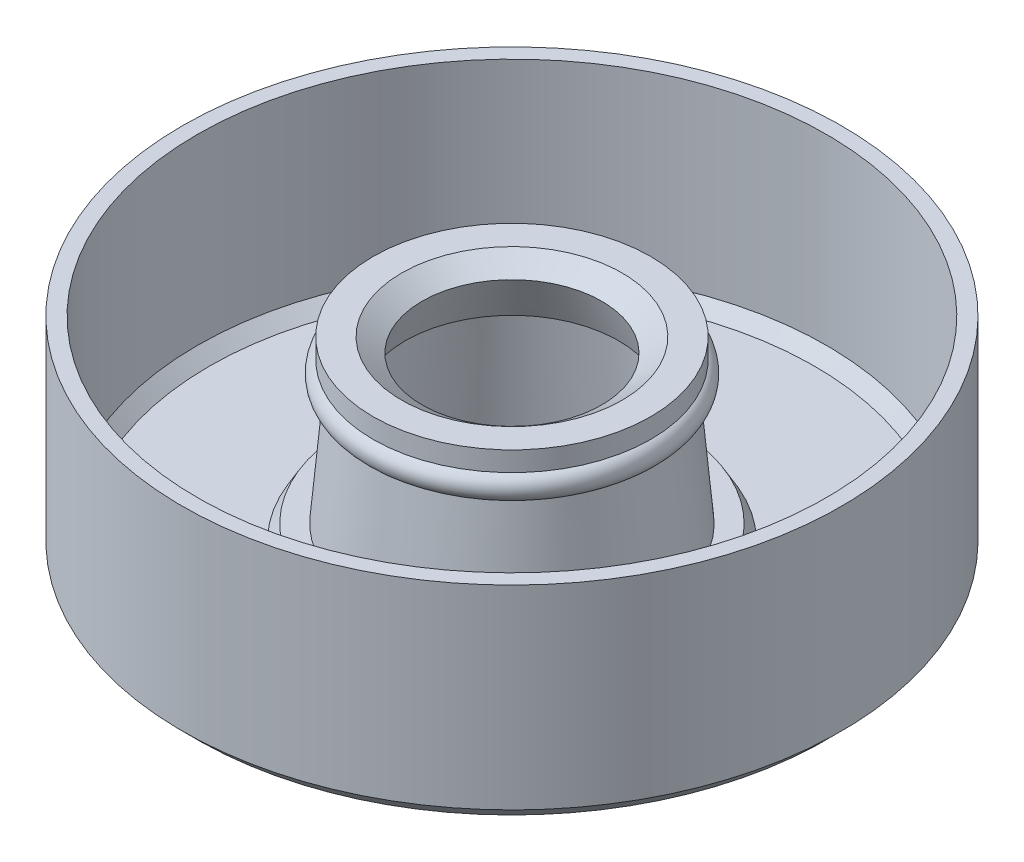
from build123d import *


with BuildPart() as part:
    # 草图1 → 旋转1 (revolve)
    with BuildSketch(Plane.XY):
        with BuildLine():
            Line((-10.5, 0), (-5.769439135, 0))
            ThreePointArc((-5.769439135, 0), (-5.259121106, 0.133562425), (-4.879665027, 0.5))
            Line((-4.879665027, 0.5), (-4.315491633, 0))
            Line((-4.315491633, 0), (-3.565536978, 0.06561253))
            Line((-3.565536978, 0.06561253), (-4.315491633, 0.5))
            Line((-4.315491633, 0.5), (-3.965536978, 4.5))
            Line((-3.965536978, 4.5), (-3.565536978, 4.5))
            Line((-3.565536978, 4.5), (-3, 5.928571429))
            Line((-3, 5.928571429), (-3.680070479, 6.404761905))
            Line((-3.680070479, 6.404761905), (-4.632451432, 6.404761905))
            Line((-4.632451432, 6.404761905), (-4.632451432, 5.747213595))
            ThreePointArc((-4.632451432, 5.747213595), (-4.867701612, 5.244464966), (-4.432451432, 4.9))
            Line((-4.432451432, 4.9), (-4.77365722, 1))
            Line((-4.77365722, 1), (-5.480764001, 1))
            Line((-5.480764001, 1), (-5.769439135, 0.5))
            Line((-5.769439135, 0.5), (-10.1, 0.5))
            Line((-10.1, 0.5), (-10.5, 0.9))
            Line((-10.5, 0.9), (-10.5, 7))
            Line((-10.5, 7), (-11, 7))
            Line((-11, 7), (-11, 0.5))
            Line((-11, 0.5), (-10.5, 0))
        make_face()
    revolve(axis=Axis((0, 5.977335763, 0), (0, -1, 0)))


solid = part.part
